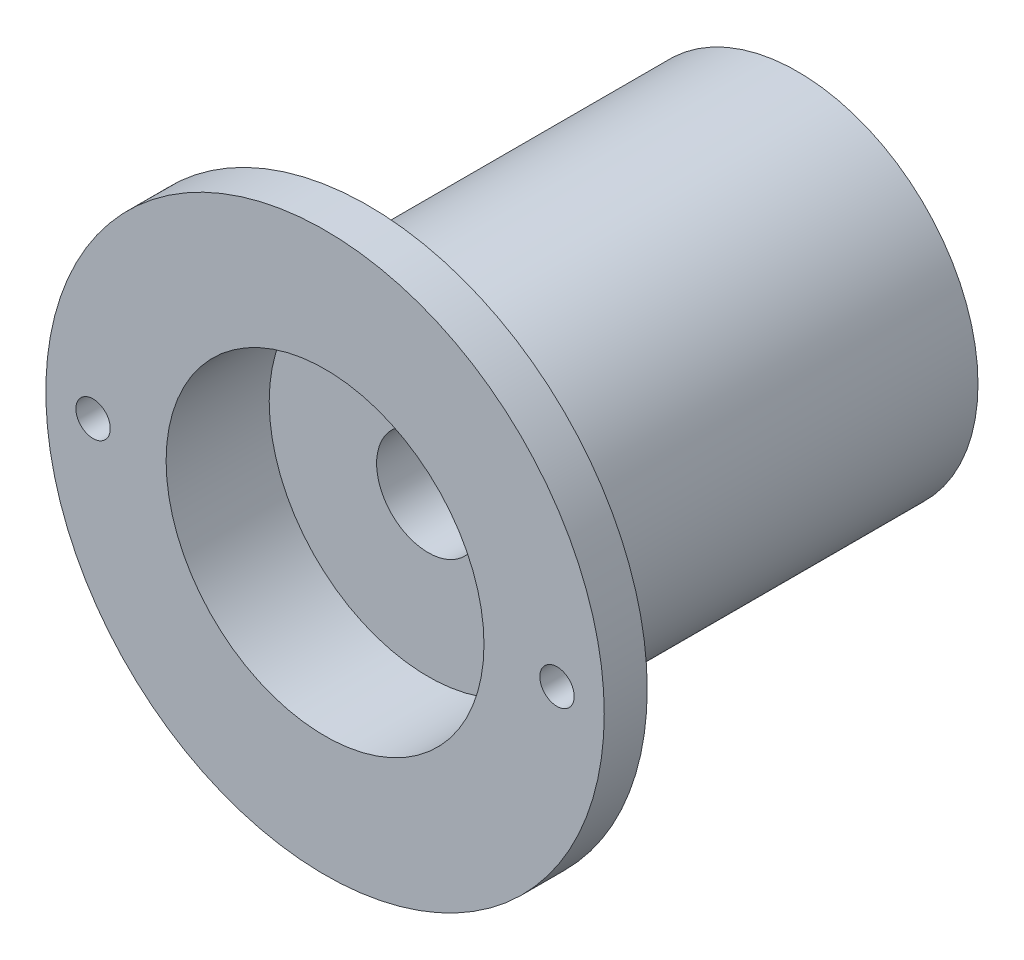
from build123d import *

# Parameters (mm, degrees)
ESQUISSE1_R             = 21
BOSS_EXTRU_1_DEPTH      = 50
ESQUISSE2_R             = 32.5
BOSS_EXTRU_2_DEPTH      = 5
ESQUISSE3_R             = 18.5
ENL_V_MAT_EXTRU_1_DEPTH = 12
ESQUISSE4_R             = 6
ENL_V_MAT_EXTRU_2_DEPTH = 49
ENL_V_START             = -12
ESQUISSE5_R             = 18.5
ENL_V_MAT_EXTRU_3_DEPTH = 12
ESQUISSE6_R             = 2
ENL_V_MAT_EXTRU_4_DEPTH = 6


with BuildPart() as part:
    # Esquisse1 → Boss.-Extru.1 (new body)
    with BuildSketch(Plane.XY):
        Circle(ESQUISSE1_R)
    extrude(amount=BOSS_EXTRU_1_DEPTH)

    # Esquisse2 → Boss.-Extru.2 (add)
    with BuildSketch(Plane.XY.offset(50)):
        Circle(ESQUISSE2_R)
    extrude(amount=BOSS_EXTRU_2_DEPTH)

    # Esquisse3 → Enlèv. mat.-Extru.1 (cut)
    with BuildSketch(Plane.XY.offset(55)):
        Circle(ESQUISSE3_R)
    extrude(amount=-ENL_V_MAT_EXTRU_1_DEPTH, mode=Mode.SUBTRACT)

    # Esquisse4 → Enlèv. mat.-Extru.2 (cut)
    with BuildSketch(Plane.XY.offset(43)):
        Circle(ESQUISSE4_R)
    extrude(amount=-ENL_V_MAT_EXTRU_2_DEPTH, mode=Mode.SUBTRACT)

    # Esquisse5 → Enlèv. mat.-Extru.3 (cut)
    with BuildSketch(Plane(origin=(0, 0, 0), x_dir=(-1, 0, 0), z_dir=(0, 0, -1)).offset(ENL_V_START)):
        with Locations(Location((0, 0, 0), (0, 0, 180))):
            Circle(ESQUISSE5_R)
    extrude(amount=ENL_V_MAT_EXTRU_3_DEPTH, mode=Mode.SUBTRACT)

    # Esquisse6 → Enlèv. mat.-Extru.4 (cut)
    with BuildSketch(Plane(origin=(0, 0, 50), x_dir=(-1, 0, 0), z_dir=(0, 0, -1))):
        with Locations((27, 0)):
            Circle(ESQUISSE6_R)
        with Locations((-27, 0)):
            Circle(ESQUISSE6_R)
    extrude(amount=-ENL_V_MAT_EXTRU_4_DEPTH, mode=Mode.SUBTRACT)


solid = part.part
